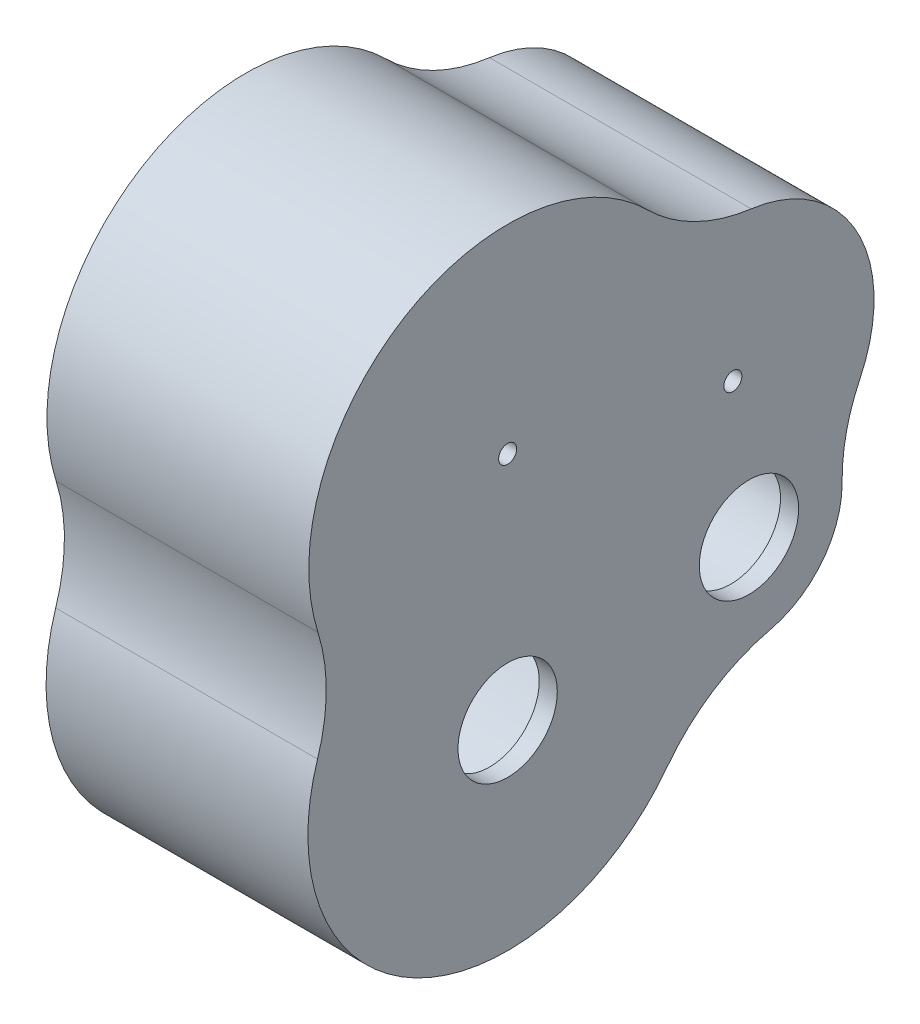
from build123d import *

# Parameters (mm, degrees)
EXTRUDE_1_DEPTH   = 12.5
EXTRUDE_START     = 2
SKETCH_2_R        = 5.5
SKETCH_2_R_2      = 1
EXTRUDE_1_2_DEPTH = 2
FILLET_1_R        = 20
FILLET_2_R        = 1


with BuildPart() as part:
    # Эскиз1 → Extrude 1 (new, symmetric)
    with BuildSketch(Plane(origin=(0, 0, 0), x_dir=(0, 0, -1), z_dir=(1, 0, 0))):
        with BuildLine():
            ThreePointArc((21.603380218, -4.775938456), (33.854747747, -3.276903371), (35.906857777, 8.894043878))
            ThreePointArc((35.906857777, 8.894043878), (38.268983914, 28.232895393), (19.951546092, 34.869331891))
            ThreePointArc((19.951546092, 34.869331891), (-11.049339337, 44.592892831), (-18.006325398, 12.856433046))
            ThreePointArc((-18.006325398, 12.856433046), (-8.99776817, -20.21276312), (21.603380218, -4.775938456))
        make_face()
        with BuildLine():
            ThreePointArc((20.106671115, -0.85872094), (31.790213298, -2.416282003), (33.306720651, 9.272659773))
            ThreePointArc((33.306720651, 9.272659773), (36.491716149, 27.303748421), (18.864481175, 32.258033567))
            ThreePointArc((18.864481175, 32.258033567), (-9.850324329, 42.974785218), (-15.489643207, 12.848602193))
            ThreePointArc((-15.489643207, 12.848602193), (-7.232006191, -18.780673882), (20.106671115, -0.85872094))
        make_face(mode=Mode.SUBTRACT)
    extrude(amount=EXTRUDE_1_DEPTH, both=True)

    # Эскиз2 → Extrude 1 2 (add)
    # profile 1 of 2: a face of its own
    with BuildSketch(Plane(origin=(12.5, 0, 0), x_dir=(0, 0, -1), z_dir=(1, 0, 0)).offset(EXTRUDE_START)):
        with BuildLine():
            ThreePointArc((35.906857777, 8.894043878), (38.268983914, 28.232895393), (19.951546092, 34.869331891))
            ThreePointArc((19.951546092, 34.869331891), (-11.049339337, 44.592892831), (-18.006325398, 12.856433046))
            ThreePointArc((-18.006325398, 12.856433046), (-8.99776817, -20.21276312), (21.603380218, -4.775938456))
            ThreePointArc((21.603380218, -4.775938456), (33.854747747, -3.276903371), (35.906857777, 8.894043878))
        make_face()
        with BuildLine():
            ThreePointArc((33.306720651, 9.272659773), (31.790213298, -2.416282003), (20.106671115, -0.85872094))
            ThreePointArc((20.106671115, -0.85872094), (-7.232006191, -18.780673882), (-15.489643207, 12.848602193))
            ThreePointArc((-15.489643207, 12.848602193), (-9.850324329, 42.974785218), (18.864481175, 32.258033567))
            ThreePointArc((18.864481175, 32.258033567), (36.491716149, 27.303748421), (33.306720651, 9.272659773))
        make_face(mode=Mode.SUBTRACT)
    # profile 2 of 2: a face of its own
    with BuildSketch(Plane(origin=(12.5, 0, 0), x_dir=(0, 0, -1), z_dir=(1, 0, 0)).offset(EXTRUDE_START)):
        with BuildLine():
            ThreePointArc((20.106671115, -0.85872094), (-7.232006191, -18.780673882), (-15.489643207, 12.848602193))
            ThreePointArc((-15.489643207, 12.848602193), (-9.850324329, 42.974785218), (18.864481175, 32.258033567))
            ThreePointArc((18.864481175, 32.258033567), (36.491716149, 27.303748421), (33.306720651, 9.272659773))
            ThreePointArc((33.306720651, 9.272659773), (31.790213298, -2.416282003), (20.106671115, -0.85872094))
        make_face()
        Circle(SKETCH_2_R, mode=Mode.SUBTRACT)
        with Locations((0, 25.54)):
            Circle(SKETCH_2_R_2, mode=Mode.SUBTRACT)
        with Locations((24.942301168, 20.046985121)):
            Circle(SKETCH_2_R_2, mode=Mode.SUBTRACT)
        with Locations((26.724491683, 4.183783491)):
            Circle(SKETCH_2_R, mode=Mode.SUBTRACT)
    extrude_1_2 = extrude(amount=-EXTRUDE_1_2_DEPTH)

    # Зеркальное отражение1: Extrude 1 2 across plane
    add(extrude_1_2.mirror(Plane(origin=(0, 0, 0), x_dir=(0, 0, 1), z_dir=(1, 0, 0))))

    # Скругление1
    fillet_1_edges = [part.edges().sort_by_distance(p)[0] for p in [
        (0, 34.869331891, -19.951546092),
        (0, 8.894043878, -35.906857777),
        (0, -4.775938456, -21.603380218),
        (0, 12.856433046, 18.006325398),
    ]]
    fillet(fillet_1_edges, radius=FILLET_1_R)

    # Скругление2
    fillet_2_edges = [part.edges().sort_by_distance(p)[0] for p in [
        (-12.5, 42.974785218, 9.850324329),
        (0, 32.258033567, -18.864481175),
        (-12.5, -18.780673882, 7.232006191),
        (0, 12.848602193, 15.489643207),
        (-12.5, -2.416282003, -31.790213298),
        (0, -0.85872094, -20.106671115),
        (-12.5, 27.303748421, -36.491716149),
        (0, 9.272659773, -33.306720651),
        (12.5, 42.974785218, 9.850324329),
        (12.5, -18.780673882, 7.232006191),
        (12.5, -2.416282003, -31.790213298),
        (12.5, 27.303748421, -36.491716149),
    ]]
    fillet(fillet_2_edges, radius=FILLET_2_R)


solid = part.part
